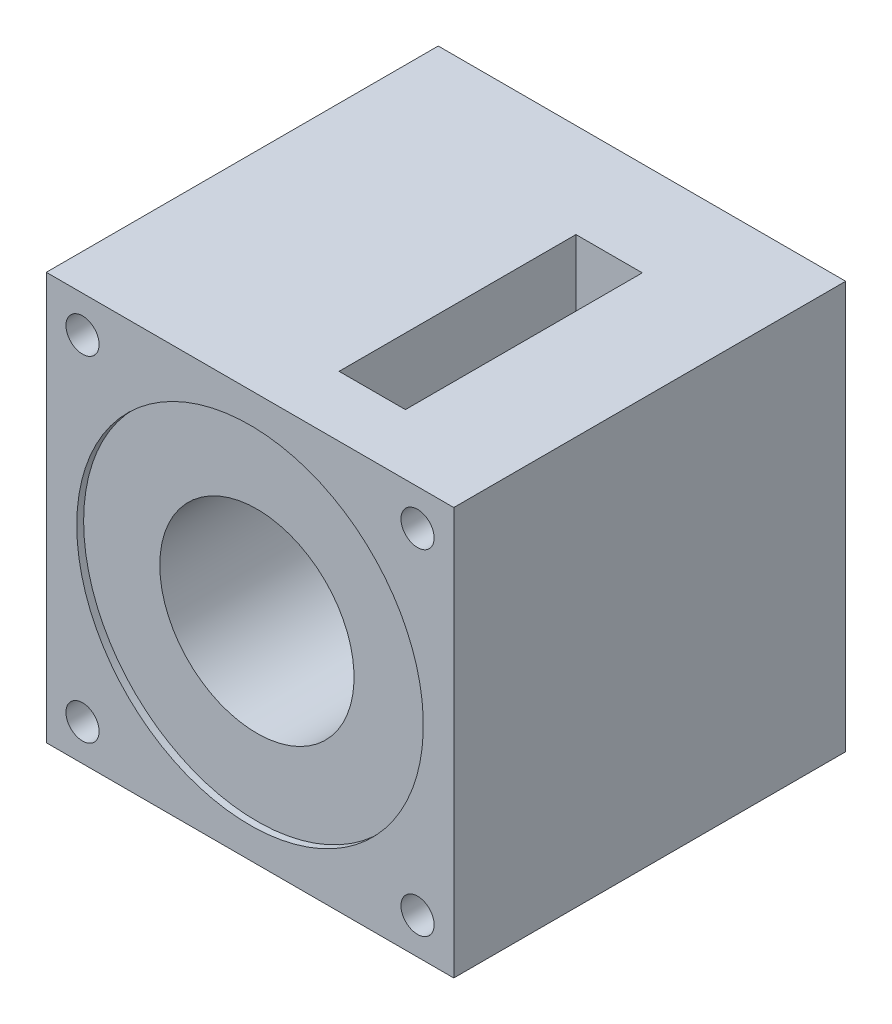
from build123d import *

# Parameters (mm, degrees)
SKETCH1_W                    = 86
SKETCH1_H                    = 86
BOSS_EXTRUDE1_DEPTH          = 82.721
SKETCH2_R                    = 36.575
CUT_EXTRUDE1_DEPTH           = 1.449994037
SKETCH3_R                    = 20.5
CUT_EXTRUDE2_DEPTH           = 61.5
SKETCH4_R                    = 18.5
CUT_EXTRUDE3_DEPTH           = 12.5
SKETCH5_R                    = 7.5
CUT_EXTRUDE4_DEPTH           = 438.22445056
CUT_EXTRUDE5_REACH           = 382.784
CUT_EXTRUDE5_END_RADIUS      = 20.5
SKETCH6_W                    = 14
SKETCH6_H                    = 50
F_7_0_7_DIAMETER_HOLE1_D     = 7
F_7_0_7_DIAMETER_HOLE1_DEPTH = 22
F_7_0_7_DIAMETER_HOLE2_D     = 7
F_7_0_7_DIAMETER_HOLE2_DEPTH = 25.000212861


with BuildPart() as part:
    # Sketch1 → Boss-Extrude1 (new body)
    with BuildSketch(Plane(origin=(0, 0, 0), x_dir=(-1, 0, 0), z_dir=(0, 0, -1))):
        with Locations((318.604600328, 194.58078929)):
            Rectangle(SKETCH1_W, SKETCH1_H)
    extrude(amount=-BOSS_EXTRUDE1_DEPTH)

    # Sketch2 → Cut-Extrude1 (cut)
    with BuildSketch(Plane.XY.offset(82.721)):
        with Locations(Location((-318.604600328, 194.58078929, 0), (0, 0, 180))):
            Circle(SKETCH2_R)
    extrude(amount=-CUT_EXTRUDE1_DEPTH, mode=Mode.SUBTRACT)

    # Sketch3 → Cut-Extrude2 (cut)
    with BuildSketch(Plane.XY.offset(81.271005963)):
        with Locations(Location((-318.604600328, 194.58078929, 0), (0, 0, 180))):
            Circle(SKETCH3_R)
    extrude(amount=-CUT_EXTRUDE2_DEPTH, mode=Mode.SUBTRACT)

    # Sketch4 → Cut-Extrude3 (cut)
    with BuildSketch(Plane(origin=(0, 0, 0), x_dir=(-1, 0, 0), z_dir=(0, 0, -1))):
        with Locations(Location((318.604600328, 194.58078929, 0), (0, 0, 180))):
            Circle(SKETCH4_R)
    extrude(amount=-CUT_EXTRUDE3_DEPTH, mode=Mode.SUBTRACT)

    # Sketch5 → Cut-Extrude4 (cut, through all)
    with BuildSketch(Plane.XY.offset(19.771005963)):
        with Locations((-318.604600328, 194.58078929)):
            Circle(SKETCH5_R)
    extrude(amount=-CUT_EXTRUDE4_DEPTH, mode=Mode.SUBTRACT)

    # Cut-Extrude5: up to this cylinder (the profile starts outside it)
    cut_extrude5_end = Plane(origin=(-318.604600328, 194.58078929, 44.930798), z_dir=(0, 0, 1)) * Cylinder(CUT_EXTRUDE5_END_RADIUS, 807.568, mode=Mode.PRIVATE)
    # Sketch6 → Cut-Extrude5 (cut, up to the surface)
    with BuildSketch(Plane(origin=(0, 237.58078929, 0), x_dir=(-1, 0, 0), z_dir=(0, 1, 0)), mode=Mode.PRIVATE) as cut_extrude5_sk1:
        with Locations((305.604600328, 44.930797937)):
            Rectangle(SKETCH6_W, SKETCH6_H)
    cut_extrude5_tool1 = extrude(cut_extrude5_sk1.sketch, amount=-CUT_EXTRUDE5_REACH, mode=Mode.PRIVATE) - cut_extrude5_end
    add(cut_extrude5_tool1.solids().sort_by_distance((-305.6046, 237.580789, 44.930798))[0], mode=Mode.SUBTRACT)

    # Ø7.0 (7) Diameter Hole1
    with Locations(Plane(origin=(0, 0, 0), x_dir=(-1, 0, 0), z_dir=(0, 0, -1))):
        with Locations((283.604600328, 159.58078929), (283.604600328, 229.58078929), (353.604600328, 159.58078929), (353.604600328, 229.58078929)):
            Hole(F_7_0_7_DIAMETER_HOLE1_D / 2, depth=F_7_0_7_DIAMETER_HOLE1_DEPTH)

    # Ø7.0 (7) Diameter Hole2
    with Locations(Plane.XY.offset(82.721)):
        with Locations((-283.249261269, 159.22545023), (-353.959939388, 229.936128349), (-283.249261269, 229.936128349), (-353.959939388, 159.22545023)):
            Hole(F_7_0_7_DIAMETER_HOLE2_D / 2, depth=F_7_0_7_DIAMETER_HOLE2_DEPTH)


solid = part.part
